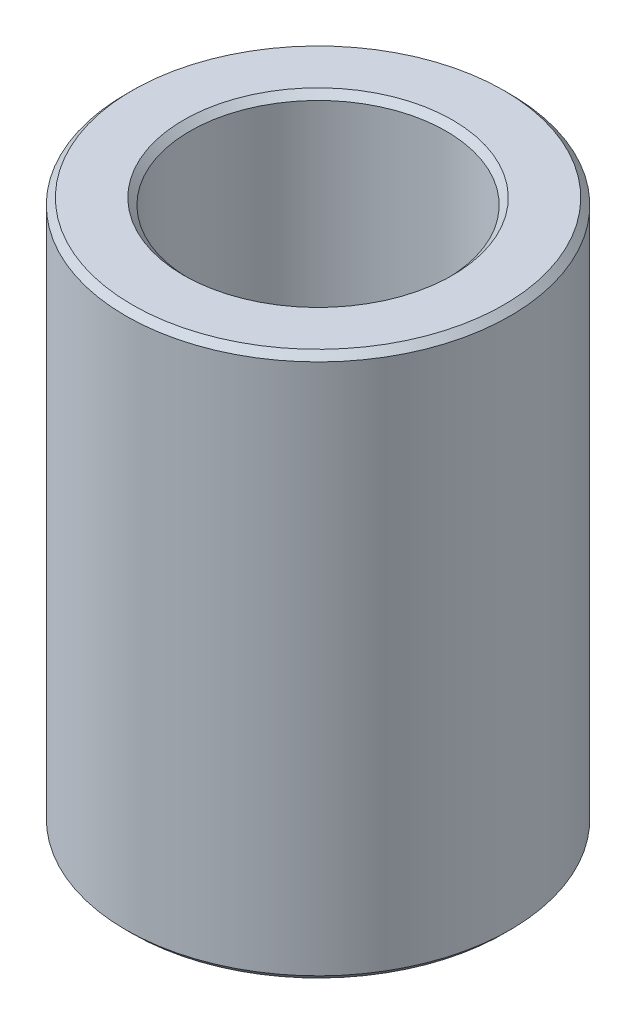
from build123d import *

# Parameters (mm, degrees)
SKETCH1_R           = 6
SKETCH1_R_2         = 4
BOSS_EXTRUDE1_DEPTH = 17
CHAMFER1_SIZE       = 0.2


with BuildPart() as part:
    # Sketch1 → Boss-Extrude1 (new body)
    with BuildSketch(Plane(origin=(0, 0, 0), x_dir=(1, 0, 0), z_dir=(0, 1, 0))):
        with Locations(Location((0, 0, 0), (0, 0, 270))):
            Circle(SKETCH1_R)
        with Locations(Location((0, 0, 0), (0, 0, 270))):
            Circle(SKETCH1_R_2, mode=Mode.SUBTRACT)
    extrude(amount=BOSS_EXTRUDE1_DEPTH)

    # Chamfer1
    chamfer1_edges = [part.edges().sort_by_distance(p)[0] for p in [
        (0, 0, -6),
        (0, 17, -6),
        (0, 0, -4),
        (0, 17, -4),
    ]]
    chamfer(chamfer1_edges, length=CHAMFER1_SIZE)


solid = part.part
